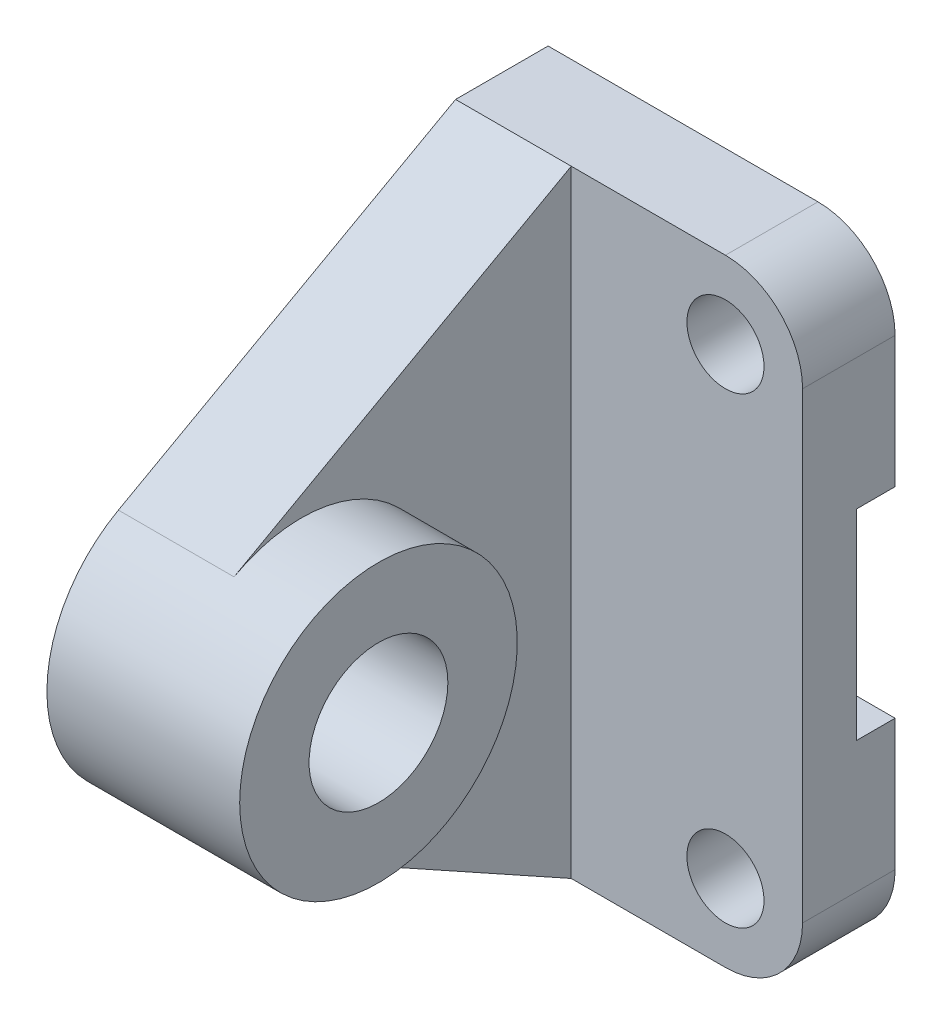
from build123d import *

# Parameters (mm, degrees)
SKETCH_2_W          = 12
SKETCH_2_H          = 80
EXTRUDE_1_DEPTH     = 45
FILLET_1_R          = 10
SKETCH_3_R          = 5
CUT_EXTRUDE_1_DEPTH = 62.392181913
SKETCH_5_W          = 10
SKETCH_5_H          = 26
CUT_EXTRUDE_2_DEPTH = 62.392181913
SKETCH_6_R          = 18
EXTRUDE_2_DEPTH     = 25
EXTRUDE_3_DEPTH     = 15
SKETCH_8_R          = 9
CUT_EXTRUDE_3_DEPTH = 81.311892021


with BuildPart() as part:
    # 草图2 → 凸台-拉伸1 (new body)
    with BuildSketch(Plane(origin=(0, 0, 0), x_dir=(0, 0, -1), z_dir=(1, 0, 0))):
        with Locations((-6, 0)):
            Rectangle(SKETCH_2_W, SKETCH_2_H)
    extrude(amount=EXTRUDE_1_DEPTH)

    # 圆角1
    fillet_1_edges = [part.edges().sort_by_distance(p)[0] for p in [
        (45, -40, 6),
        (45, 40, 6),
    ]]
    fillet(fillet_1_edges, radius=FILLET_1_R)

    # 草图3 → 切除-拉伸1 (cut, through all)
    with BuildSketch(Plane.XY.offset(12)):
        with Locations((35, 30)):
            Circle(SKETCH_3_R)
        with Locations((35, -30)):
            Circle(SKETCH_3_R)
    extrude(amount=-CUT_EXTRUDE_1_DEPTH, mode=Mode.SUBTRACT)

    # 草图5 → 切除-拉伸2 (cut, through all)
    with BuildSketch(Plane(origin=(45, 0, 0), x_dir=(0, 0, -1), z_dir=(1, 0, 0))):
        Rectangle(SKETCH_5_W, SKETCH_5_H)
    extrude(amount=-CUT_EXTRUDE_2_DEPTH, mode=Mode.SUBTRACT)



with BuildPart() as body_2:
    # 草图6 → 凸台-拉伸2 (new body)
    with BuildSketch(Plane.ZY):
        with Locations((47, 0)):
            Circle(SKETCH_6_R)
    extrude(amount=-EXTRUDE_2_DEPTH)


with BuildPart() as part_1:
    add(part.part)

    add(body_2.part)  # 凸台-拉伸3 merges body 2
    # 草图7 → 凸台-拉伸3 (add)
    with BuildSketch(Plane.ZY):
        with BuildLine():
            Line((12, 40), (55.731751958, 15.740282963))
            ThreePointArc((55.731751958, 15.740282963), (65, 0), (55.731751958, -15.740282963))
            Line((55.731751958, -15.740282963), (12, -40))
            Line((12, -40), (12, 40))
        make_face()
    extrude(amount=-EXTRUDE_3_DEPTH)

    # 草图8 → 切除-拉伸3 (cut, through all)
    with BuildSketch(Plane(origin=(25, 0, 0), x_dir=(0, 0, -1), z_dir=(1, 0, 0))):
        with Locations((-47, 0)):
            Circle(SKETCH_8_R)
    extrude(amount=-CUT_EXTRUDE_3_DEPTH, mode=Mode.SUBTRACT)


solid = part_1.part
